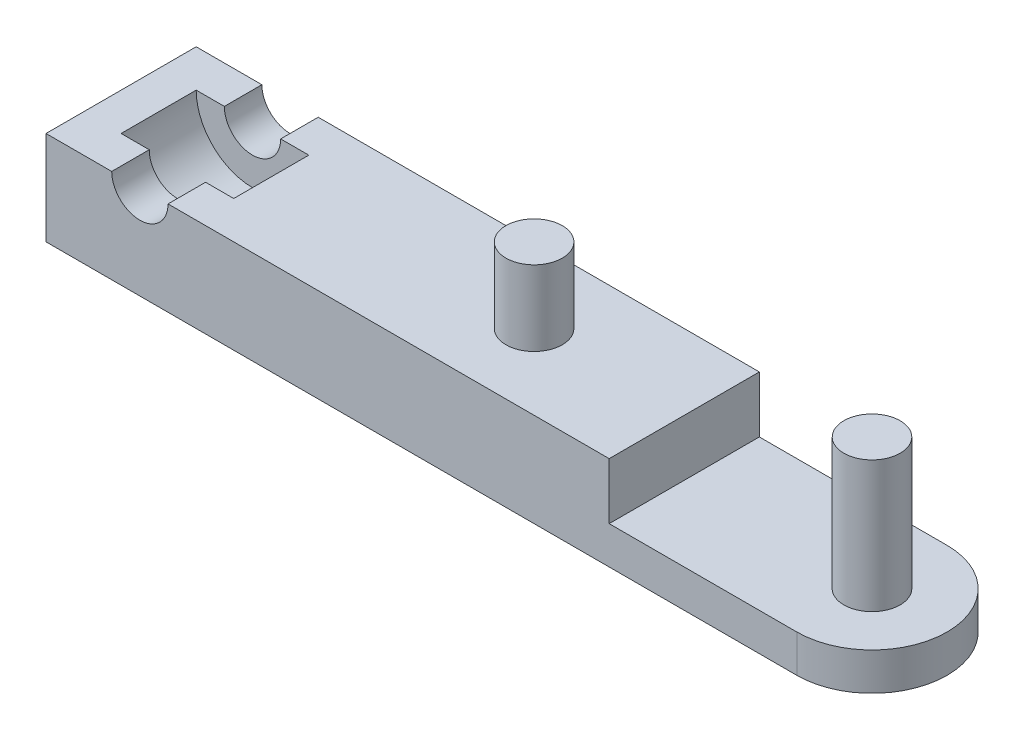
from build123d import *

# Parameters (mm, degrees)
BOSS_EXTRUDE2_DEPTH     = 2
SKETCH3_W               = 30
SKETCH3_H               = 8
BOSS_EXTRUDE3_DEPTH     = 3
SKETCH4_R               = 1.5
BOSS_EXTRUDE4_DEPTH     = 7
SKETCH12_R              = 1.5
BOSS_EXTRUDE6_DEPTH     = 4
CUT_EXTRUDE1_DEPTH      = 71.042844031
CUT_EXTRUDE2_DEPTH      = 2
CUT_EXTRUDE2_DEPTH_BACK = 2


with BuildPart() as part:
    # Sketch1 → Boss-Extrude2 (new body)
    with BuildSketch(Plane(origin=(0, 0, 0), x_dir=(1, 0, 0), z_dir=(0, 1, 0))):
        with BuildLine():
            Line((25, -4), (65, -4))
            ThreePointArc((65, -4), (69, 0), (65, 4))
            Line((65, 4), (25, 4))
            Line((25, 4), (25, -4))
        make_face()
    extrude(amount=BOSS_EXTRUDE2_DEPTH)

    # Sketch3 → Boss-Extrude3 (add)
    with BuildSketch(Plane(origin=(0, 2, 0), x_dir=(1, 0, 0), z_dir=(0, 1, 0))):
        with Locations((40, 0)):
            Rectangle(SKETCH3_W, SKETCH3_H)
    extrude(amount=BOSS_EXTRUDE3_DEPTH)

    # Sketch4 → Boss-Extrude4 (add)
    with BuildSketch(Plane(origin=(0, 2, 0), x_dir=(1, 0, 0), z_dir=(0, 1, 0))):
        with Locations(Location((65, 0, 0), (0, 0, 270))):
            Circle(SKETCH4_R)
    extrude(amount=BOSS_EXTRUDE4_DEPTH)

    # Sketch12 → Boss-Extrude6 (add)
    with BuildSketch(Plane(origin=(0, 5, 0), x_dir=(1, 0, 0), z_dir=(0, 1, 0))):
        with Locations(Location((47, 0, 0), (0, 0, 270))):
            Circle(SKETCH12_R)
    extrude(amount=BOSS_EXTRUDE6_DEPTH)

    # Sketch13 → Cut-Extrude1 (cut, through all)
    with BuildSketch(Plane.XY.offset(4)):
        with BuildLine():
            Line((31.5, 5), (28.5, 5))
            ThreePointArc((28.5, 5), (30, 3.5), (31.5, 5))
        make_face()
    extrude(amount=-CUT_EXTRUDE1_DEPTH, mode=Mode.SUBTRACT)

    # Sketch14 → Cut-Extrude2 (cut, two sides: drawn at the far end of the back side and taken through both)
    with BuildSketch(Plane.XY.offset(-CUT_EXTRUDE2_DEPTH_BACK)):
        with BuildLine():
            Line((27, 5), (33, 5))
            ThreePointArc((33, 5), (30, 2), (27, 5))
        make_face()
    extrude(amount=CUT_EXTRUDE2_DEPTH + CUT_EXTRUDE2_DEPTH_BACK, mode=Mode.SUBTRACT)


solid = part.part
